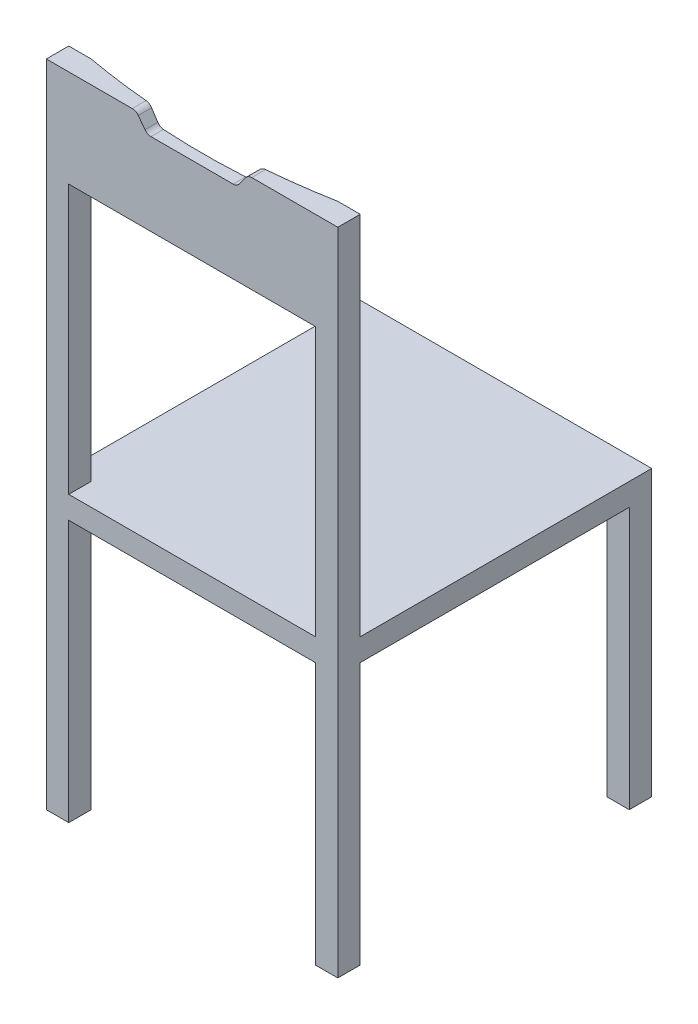
from build123d import *

# Parameters (mm, degrees)
BOSS_EXTRUDE1_DEPTH        = 489.54
BOSS_EXTRUDE1_DEPTH_BACK   = 430
SKETCH2_W                  = 30
SKETCH2_H                  = 30
BOSS_EXTRUDE1_2_DEPTH      = 489.54
BOSS_EXTRUDE1_2_DEPTH_BACK = 430
SKETCH3_W                  = 30
SKETCH3_H                  = 30
BOSS_EXTRUDE2_DEPTH        = 430
BOSS_EXTRUDE2_2_DEPTH      = 430
BOSS_EXTRUDE3_DEPTH        = 30
BOSS_EXTRUDE4_DEPTH        = 130
CUT_EXTRUDE2_REACH         = 675.85
CUT_EXTRUDE2_END_RADIUS    = 915
FILLET1_R                  = 10
SKETCH8_W                  = 390
SKETCH8_H                  = 49.54
CUT_EXTRUDE3_DEPTH         = 674.850437188


with BuildPart() as part:
    # Sketch2 → Boss-Extrude1 (new, two sides: drawn at the far end of the back side and taken through both)
    with BuildSketch(Plane(origin=(0, 0, 0), x_dir=(1, 0, 0), z_dir=(0, 1, 0)).offset(-BOSS_EXTRUDE1_DEPTH_BACK)):
        with Locations((-180, -195)):
            Rectangle(SKETCH2_W, SKETCH2_H)
    extrude(amount=BOSS_EXTRUDE1_DEPTH + BOSS_EXTRUDE1_DEPTH_BACK)



with BuildPart() as body_2:
    # Sketch2 → Boss-Extrude1 2 (new, two sides: drawn at the far end of the back side and taken through both)
    with BuildSketch(Plane(origin=(0, 0, 0), x_dir=(1, 0, 0), z_dir=(0, 1, 0)).offset(-BOSS_EXTRUDE1_2_DEPTH_BACK)):
        with Locations((180, -195)):
            Rectangle(SKETCH2_W, SKETCH2_H)
    extrude(amount=BOSS_EXTRUDE1_2_DEPTH + BOSS_EXTRUDE1_2_DEPTH_BACK)


with BuildPart() as body_3:
    # Sketch3 → Boss-Extrude2 (new body)
    with BuildSketch(Plane(origin=(0, 0, 0), x_dir=(1, 0, 0), z_dir=(0, 1, 0))):
        with Locations((-180, 195)):
            Rectangle(SKETCH3_W, SKETCH3_H)
    extrude(amount=-BOSS_EXTRUDE2_DEPTH)


with BuildPart() as body_4:
    # Sketch3 → Boss-Extrude2 2 (new body)
    with BuildSketch(Plane(origin=(0, 0, 0), x_dir=(1, 0, 0), z_dir=(0, 1, 0))):
        with Locations((180, 195)):
            Rectangle(SKETCH3_W, SKETCH3_H)
    extrude(amount=-BOSS_EXTRUDE2_2_DEPTH)


with BuildPart() as part_1:
    add(part.part)

    add(body_2.part)  # Boss-Extrude3 merges body 2

    add(body_3.part)  # Boss-Extrude3 merges body 3

    add(body_4.part)  # Boss-Extrude3 merges body 4
    # Sketch4 → Boss-Extrude3 (add)
    with BuildSketch(Plane(origin=(0, 0, 0), x_dir=(1, 0, 0), z_dir=(0, 1, 0))):
        Polygon((-165, 210), (165, 210), (165, 180), (195, 180), (195, -180), (165, -180), (165, -210), (-165, -210), (-165, -180), (-195, -180), (-195, 180), (-165, 180), align=None)
    extrude(amount=-BOSS_EXTRUDE3_DEPTH)

    # Sketch5 → Boss-Extrude4 (add)
    with BuildSketch(Plane(origin=(0, 489.54, 0), x_dir=(1, 0, 0), z_dir=(0, 1, 0))):
        with BuildLine():
            Line((-165, -180), (-165, -210))
            Line((-165, -210), (165, -210))
            Line((165, -210), (165, -180))
            ThreePointArc((165, -180), (0, -195), (-165, -180))
        make_face()
    extrude(amount=-BOSS_EXTRUDE4_DEPTH)

    # Cut-Extrude2: up to this cylinder (the profile starts outside it)
    cut_extrude2_end = Plane(origin=(0, 479.936128, -720), z_dir=(0, 1, 0)) * Cylinder(CUT_EXTRUDE2_END_RADIUS, 3182.7, mode=Mode.PRIVATE)
    # Sketch7 → Cut-Extrude2 (cut, up to the surface)
    with BuildSketch(Plane.XY.offset(210), mode=Mode.PRIVATE) as cut_extrude2_sk1:
        with BuildLine():
            Line((75, 489.54), (-75, 489.54))
            Line((-75, 489.54), (-63, 473.54))
            ThreePointArc((-63, 473.54), (-59.472135955, 470.59572809), (-55, 469.54))
            Line((-55, 469.54), (55, 469.54))
            ThreePointArc((55, 469.54), (59.472135955, 470.59572809), (63, 473.54))
            Line((63, 473.54), (75, 489.54))
        make_face()
    cut_extrude2_tool1 = extrude(cut_extrude2_sk1.sketch, amount=-CUT_EXTRUDE2_REACH, mode=Mode.PRIVATE) - cut_extrude2_end
    add(cut_extrude2_tool1.solids().sort_by_distance((0, 479.936128, 210))[0], mode=Mode.SUBTRACT)

    # Fillet1
    fillet1_edges = [part_1.edges().sort_by_distance(p)[0] for p in [
        (75, 489.54, 200.960524607),
        (-75, 489.54, 200.960524607),
    ]]
    fillet(fillet1_edges, radius=FILLET1_R)

    # Sketch8 → Cut-Extrude3 (cut, through all)
    with BuildSketch(Plane.XY.offset(210)):
        with Locations((0, -405.23)):
            Rectangle(SKETCH8_W, SKETCH8_H)
    extrude(amount=-CUT_EXTRUDE3_DEPTH, mode=Mode.SUBTRACT)


solid = part_1.part
